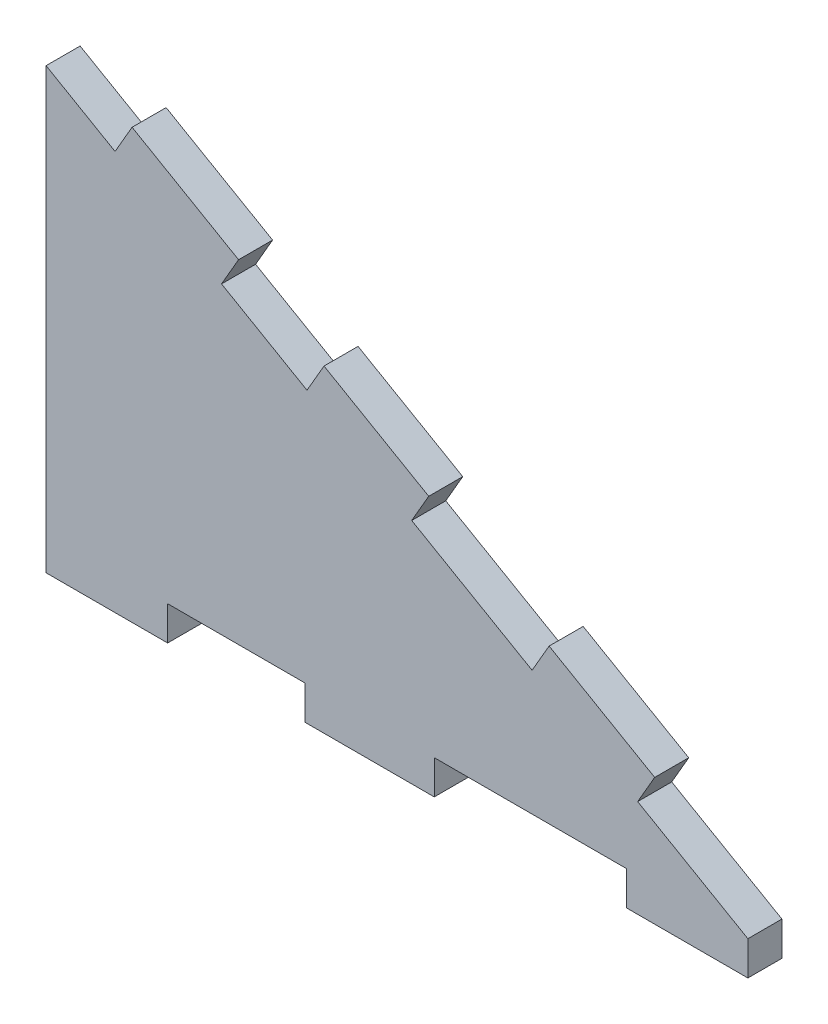
from build123d import *

# Parameters (mm, degrees)
SKETCH1_W           = 109.982
SKETCH1_H           = 63.5
BOSS_EXTRUDE1_DEPTH = 5.334
CUT_EXTRUDE1_DEPTH  = 128.109173076
SKETCH7_W           = 19.05
SKETCH7_H           = 5.334
SKETCH7_W_2         = 20.295839927
BOSS_EXTRUDE4_DEPTH = 5.334
SKETCH9_W           = 19.270046927
SKETCH9_H           = 5.334
SKETCH9_W_2         = 18.946166646
SKETCH9_W_3         = 19.104051368
BOSS_EXTRUDE6_DEPTH = 5.334


with BuildPart() as part:
    # Sketch1 → Boss-Extrude1 (new body)
    with BuildSketch(Plane.XY):
        with Locations((54.991, 31.75)):
            Rectangle(SKETCH1_W, SKETCH1_H)
    extrude(amount=BOSS_EXTRUDE1_DEPTH)

    # Sketch2 → Cut-Extrude1 (cut, through all)
    with BuildSketch(Plane.XY.offset(5.334)):
        Polygon((0, 63.5), (109.982, 0), (109.982, 63.5), align=None)
    extrude(amount=-CUT_EXTRUDE1_DEPTH, mode=Mode.SUBTRACT)

    # Sketch7 → Boss-Extrude4 (add)
    with BuildSketch(Plane(origin=(0, 0, 0), x_dir=(-1, 0, 0), z_dir=(0, -1, 0))):
        with Locations((-9.525, -2.667)):
            Rectangle(SKETCH7_W, SKETCH7_H)
        with Locations((-50.685821834, -2.667)):
            Rectangle(SKETCH7_W_2, SKETCH7_H)
        with Locations((-100.457, -2.667)):
            Rectangle(SKETCH7_W, SKETCH7_H)
    extrude(amount=BOSS_EXTRUDE4_DEPTH)

    # Sketch9 → Boss-Extrude6 (add)
    with BuildSketch(Plane(origin=(27.496709855, 47.624301469, 0), x_dir=(0.866019052628739, -0.5000110003630135, 0), z_dir=(0.5000110003630134, 0.8660190526287389, 0))):
        with Locations((-9.635023464, -2.667)):
            Rectangle(SKETCH9_W, SKETCH9_H)
        with Locations((24.937675247, -2.667)):
            Rectangle(SKETCH9_W_2, SKETCH9_H)
        with Locations((65.750875897, -2.667)):
            Rectangle(SKETCH9_W_3, SKETCH9_H)
    extrude(amount=BOSS_EXTRUDE6_DEPTH)


solid = part.part
